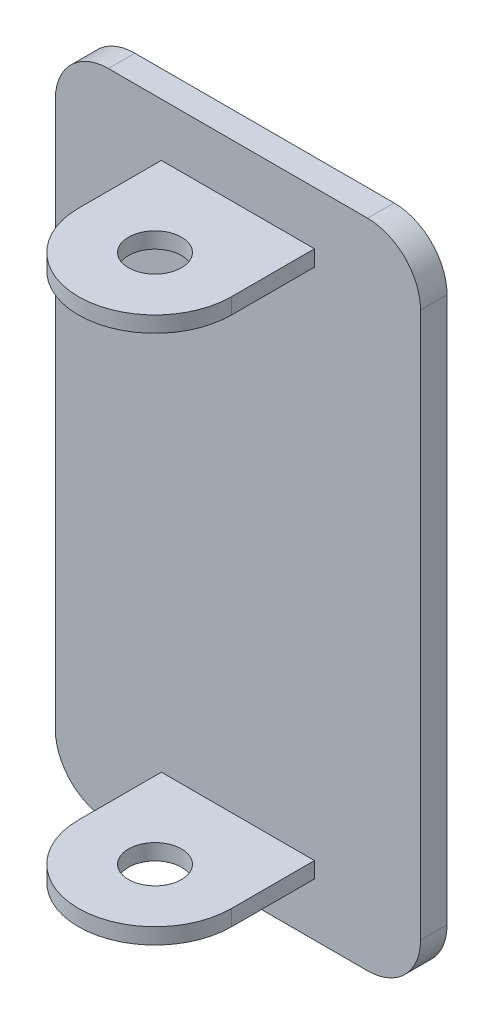
from build123d import *

# Parameters (mm, degrees)
SKETCH1_R           = 5
BOSS_EXTRUDE1_DEPTH = 102.9
SKETCH2_W           = 28.867513459
SKETCH2_H           = 96.9
CUT_EXTRUDE1_DEPTH  = 217
BOSS_EXTRUDE2_DEPTH = 5


with BuildPart() as part:
    # Sketch1 → Boss-Extrude1 (new body)
    with BuildSketch(Plane(origin=(0, 0, 0), x_dir=(1, 0, 0), z_dir=(0, 1, 0))):
        with BuildLine():
            Line((-28.867513459, -84.364700653), (0, -84.364700653))
            Line((0, -84.364700653), (0, -100))
            ThreePointArc((0, -100), (-14.43375673, -114.43375673), (-28.867513459, -100))
            Line((-28.867513459, -100), (-28.867513459, -84.364700653))
        make_face()
        with Locations(Location((-14.43375673, -100, 0), (0, 0, 270))):
            Circle(SKETCH1_R, mode=Mode.SUBTRACT)
    extrude(amount=BOSS_EXTRUDE1_DEPTH)

    # Sketch2 → Cut-Extrude1 (cut)
    with BuildSketch(Plane.XY):
        with Locations((-14.43375673, 51.45)):
            Rectangle(SKETCH2_W, SKETCH2_H)
    extrude(amount=CUT_EXTRUDE1_DEPTH, mode=Mode.SUBTRACT)


with BuildPart() as cut_extrude1_piece_1:
    # of the separate pieces the step leaves, piece 1, a body of its own (cut_extrude1_pieces)
    add(part.part.solids().sort_by_distance((-28.867513459, 0, 100))[0])



with BuildPart() as cut_extrude1_piece_2:
    # of the separate pieces the step leaves, piece 2, a body of its own (cut_extrude1_pieces)
    add(part.part.solids().sort_by_distance((-28.867513459, 99.9, 84.364700653))[0])


with BuildPart() as cut_extrude1_piece_1_1:
    add(cut_extrude1_piece_1.part)

    add(cut_extrude1_piece_2.part)  # Boss-Extrude2 merges Cut-Extrude1 piece 2
    # Sketch5 → Boss-Extrude2 (add)
    with BuildSketch(Plane(origin=(0, 0, 84.364700653), x_dir=(-1, 0, 0), z_dir=(0, 0, -1))):
        with BuildLine():
            Line((-10, 112.9), (38.867513459, 112.9))
            ThreePointArc((38.867513459, 112.9), (45.938581271, 109.971067812), (48.867513459, 102.9))
            Line((48.867513459, 102.9), (48.867513459, 0))
            ThreePointArc((48.867513459, 0), (45.938581271, -7.071067812), (38.867513459, -10))
            Line((38.867513459, -10), (-10, -10))
            ThreePointArc((-10, -10), (-17.071067812, -7.071067812), (-20, 0))
            Line((-20, 0), (-20, 102.9))
            ThreePointArc((-20, 102.9), (-17.071067812, 109.971067812), (-10, 112.9))
        make_face()
    extrude(amount=BOSS_EXTRUDE2_DEPTH)


solid = cut_extrude1_piece_1_1.part
